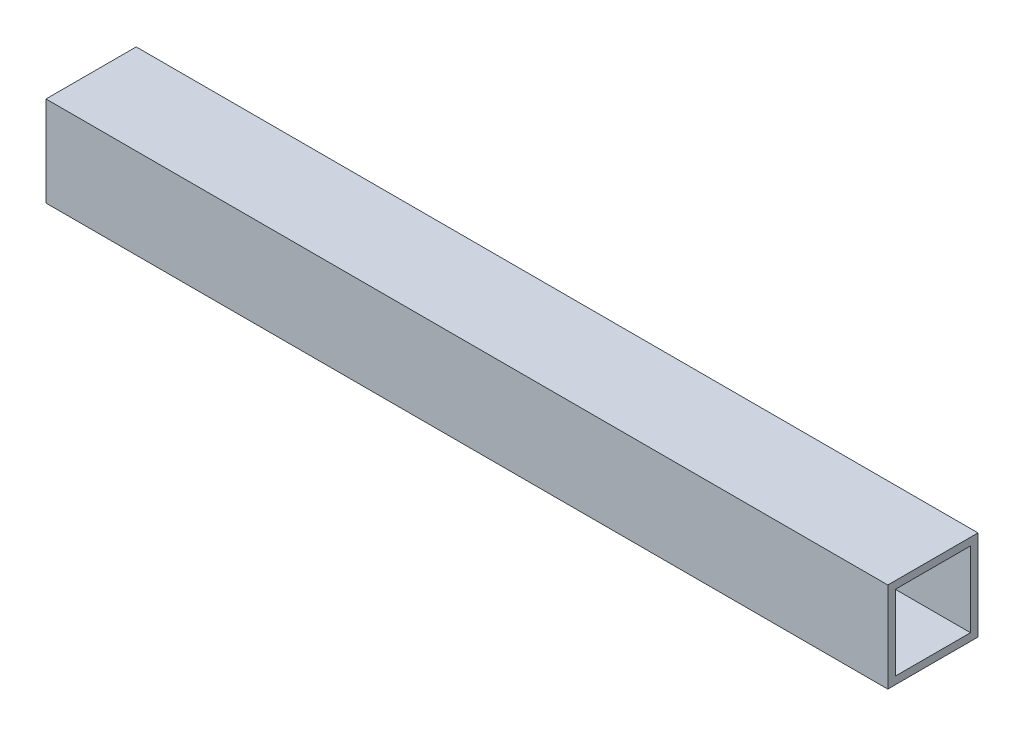
from build123d import *

# Parameters (mm, degrees)
SKETCH1_W           = 19.05
SKETCH1_H           = 19.05
SKETCH1_W_2         = 15.875
SKETCH1_H_2         = 15.875
BOSS_EXTRUDE1_DEPTH = 88.9


with BuildPart() as part:
    # Sketch1 → Boss-Extrude1 (new, symmetric)
    with BuildSketch(Plane(origin=(0, 0, 0), x_dir=(0, -1, 0), z_dir=(1, 0, 0))):
        Rectangle(SKETCH1_W, SKETCH1_H)
        Rectangle(SKETCH1_W_2, SKETCH1_H_2, mode=Mode.SUBTRACT)
    extrude(amount=BOSS_EXTRUDE1_DEPTH, both=True)


solid = part.part
